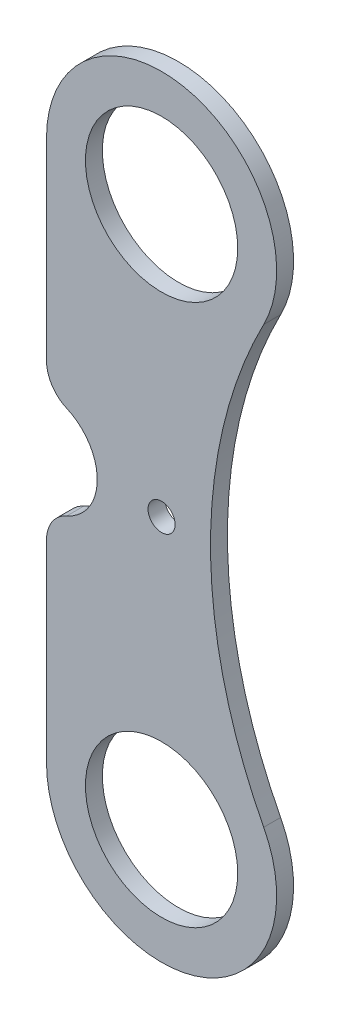
from build123d import *

# Parameters (mm, degrees)
SKETCH1_R           = 14.2875
SKETCH1_R_2         = 2.54
BOSS_EXTRUDE1_DEPTH = 3.175
CUT_EXTRUDE1_DEPTH  = 162.674043733
FILLET3_R           = 6.35
SKETCH3_R           = 2.54
BOSS_EXTRUDE3_DEPTH = 3.175
SKETCH6_R           = 2.54
BOSS_EXTRUDE4_DEPTH = 3.175
FILLET2_R           = 6.35
CUT_EXTRUDE2_DEPTH  = 169.237022961
CUT_EXTRUDE3_DEPTH  = 169.237022961
CUT_EXTRUDE4_DEPTH  = 168.265702461


with BuildPart() as part:
    # Sketch1 → Boss-Extrude1 (new body)
    with BuildSketch(Plane.XY):
        with BuildLine():
            Line((-8.89, 25.4), (8.89, 25.4))
            ThreePointArc((8.89, 25.4), (17.870256121, 21.680256121), (21.59, 12.7))
            Line((21.59, 12.7), (21.59, -117.775079775))
            ThreePointArc((21.59, -117.775079775), (21.127743647, -120.388718212), (19.797058824, -122.685251408))
            Line((19.797058824, -122.685251408), (-7.952696208, -155.616779465))
            ThreePointArc((-7.952696208, -155.616779465), (-12.268297602, -157.851943494), (-16.900388255, -156.380852124))
            Line((-16.900388255, -156.380852124), (-32.439211784, -143.287061102))
            ThreePointArc((-32.439211784, -143.287061102), (-34.674375812, -138.971459708), (-33.203284443, -134.339369055))
            Line((-33.203284443, -134.339369055), (-23.382941176, -122.685251408))
            ThreePointArc((-23.382941176, -122.685251408), (-22.052256353, -120.388718212), (-21.59, -117.775079775))
            Line((-21.59, -117.775079775), (-21.59, 12.7))
            ThreePointArc((-21.59, 12.7), (-17.870256121, 21.680256121), (-8.89, 25.4))
        make_face()
        Circle(SKETCH1_R, mode=Mode.SUBTRACT)
        with Locations((0, -101.6)):
            Circle(SKETCH1_R, mode=Mode.SUBTRACT)
        with Locations((-18.532085478, -142.550133084)):
            Circle(SKETCH1_R_2, mode=Mode.SUBTRACT)
        with Locations((0, -50.8)):
            Circle(SKETCH1_R_2, mode=Mode.SUBTRACT)
    extrude(amount=BOSS_EXTRUDE1_DEPTH)

    # Sketch2 → Cut-Extrude1 (cut, through all)
    with BuildSketch(Plane.XY):
        with BuildLine():
            ThreePointArc((19.159083004, -91.647229609), (9.182340769, -50.8), (19.159083004, -9.952770391))
            ThreePointArc((19.159083004, -9.952770391), (20.973467787, -5.122670102), (21.59, 0))
            Line((21.59, 0), (27.94, 0))
            Line((27.94, 0), (27.94, -121.656687185))
            Line((27.94, -121.656687185), (-7.620284479, -163.8572221))
            Line((-7.620284479, -163.8572221), (-17.501317584, -155.874478972))
            Line((-17.501317584, -155.874478972), (16.51, -115.512152961))
            ThreePointArc((16.51, -115.512152961), (20.280273667, -109.005308906), (21.59, -101.6))
            ThreePointArc((21.59, -101.6), (20.973467787, -96.477329898), (19.159083004, -91.647229609))
        make_face()
        with BuildLine():
            Line((-21.59, -41.275), (-21.59, -60.325))
            ThreePointArc((-21.59, -60.325), (-12.065, -50.8), (-21.59, -41.275))
        make_face()
    extrude(amount=CUT_EXTRUDE1_DEPTH, mode=Mode.SUBTRACT)


with BuildPart() as cut_extrude1_piece_1:
    # of the separate pieces the step leaves, piece 1, a body of its own (cut_extrude1_pieces)
    add(part.part.solids().sort_by_distance((-8.89, 25.4, 0))[0])

    # Fillet3
    fillet3_edges = [cut_extrude1_piece_1.edges().sort_by_distance(p)[0] for p in [
        (-21.59, -41.275, 1.5875),
        (-21.59, -60.325, 1.5875),
    ]]
    fillet(fillet3_edges, radius=FILLET3_R)

    # Sketch3 → Boss-Extrude3 (add)
    with BuildSketch(Plane.XY.offset(3.175)):
        with BuildLine():
            Line((-27.351416194, -127.394768527), (-36.025496499, -137.688579))
            ThreePointArc((-36.025496499, -137.688579), (-37.217489152, -141.441859142), (-35.4063854, -144.93869507))
            Line((-35.4063854, -144.93869507), (-24.403104784, -154.210610454))
            ThreePointArc((-24.403104784, -154.210610454), (-19.771014132, -155.681701823), (-15.455412737, -153.446537795))
            Line((-15.455412737, -153.446537795), (-7.557639641, -144.073996091))
            Line((-7.557639641, -144.073996091), (-27.351416194, -127.394768527))
        make_face()
        with Locations((-18.532085478, -142.550133084)):
            Circle(SKETCH3_R, mode=Mode.SUBTRACT)
    extrude(amount=-BOSS_EXTRUDE3_DEPTH)

    # Sketch6 → Boss-Extrude4 (add)
    with BuildSketch(Plane.XY.offset(3.175)):
        Polygon((-35.4063854, -144.93869507), (-63.620410749, -121.164144113), (-51.344981666, -106.596497054), (-27.065569901, -127.055545526), align=None)
        with Locations((-52.626813855, -117.972130278)):
            Circle(SKETCH6_R, mode=Mode.SUBTRACT)
    extrude(amount=-BOSS_EXTRUDE4_DEPTH)

    # Fillet2
    fillet2_edges = [cut_extrude1_piece_1.edges().sort_by_distance(p)[0] for p in [
        (-63.620410749, -121.164144113, 1.5875),
        (-51.344981666, -106.596497054, 1.5875),
        (-27.065569901, -127.055545526, 1.5875),
    ]]
    fillet(fillet2_edges, radius=FILLET2_R)

    # Sketch7 → Cut-Extrude2 (cut, through all)
    with BuildSketch(Plane.XY.offset(3.175)):
        with BuildLine():
            Line((-21.59, 0), (-21.59, 31.75))
            Line((-21.59, 31.75), (21.59, 31.75))
            Line((21.59, 31.75), (21.59, 0))
            ThreePointArc((21.59, 0), (0, 21.59), (-21.59, 0))
        make_face()
    extrude(amount=-CUT_EXTRUDE2_DEPTH, mode=Mode.SUBTRACT)


with BuildPart() as cut_extrude1_piece_2:
    # of the separate pieces the step leaves, piece 2, a body of its own (cut_extrude1_pieces)
    add(part.part.solids().sort_by_distance((-16.900388255, -156.380852124, 0))[0])


with BuildPart() as cut_extrude3_tool:
    # Sketch10 → Cut-Extrude3 (new, through all)
    with BuildSketch(Plane.XY.offset(3.175)):
        with BuildLine():
            Line((-18.151882461, -155.32628042), (-17.361482582, -157.512020269))
            Line((-17.361482582, -157.512020269), (-14.375706423, -156.432313955))
            Line((-14.375706423, -156.432313955), (-15.455412737, -153.446537795))
            ThreePointArc((-15.455412737, -153.446537795), (-16.679911193, -154.563907595), (-18.151882461, -155.32628042))
        make_face()
    extrude(amount=-CUT_EXTRUDE3_DEPTH)


with BuildPart() as cut_extrude1_piece_1_1:
    add(cut_extrude1_piece_1.part)

    # Cut-Extrude3: cut by cut_extrude3_tool
    add(cut_extrude3_tool.part, mode=Mode.SUBTRACT)

    # Sketch12 → Cut-Extrude4 (cut, through all)
    with BuildSketch(Plane.XY.offset(3.175)):
        with BuildLine():
            Line((-21.59, -101.6), (-72.39, -101.6))
            Line((-72.39, -101.6), (-72.39, -165.1))
            Line((-72.39, -165.1), (16.51, -165.1))
            Line((16.51, -165.1), (16.51, -115.512152961))
            ThreePointArc((16.51, -115.512152961), (-7.405308906, -121.880273667), (-21.59, -101.6))
        make_face()
    extrude(amount=-CUT_EXTRUDE4_DEPTH, mode=Mode.SUBTRACT)


with BuildPart() as cut_extrude1_piece_2_1:
    add(cut_extrude1_piece_2.part)

    # Cut-Extrude3: cut by cut_extrude3_tool
    add(cut_extrude3_tool.part, mode=Mode.SUBTRACT)


solid = cut_extrude1_piece_1_1.part
